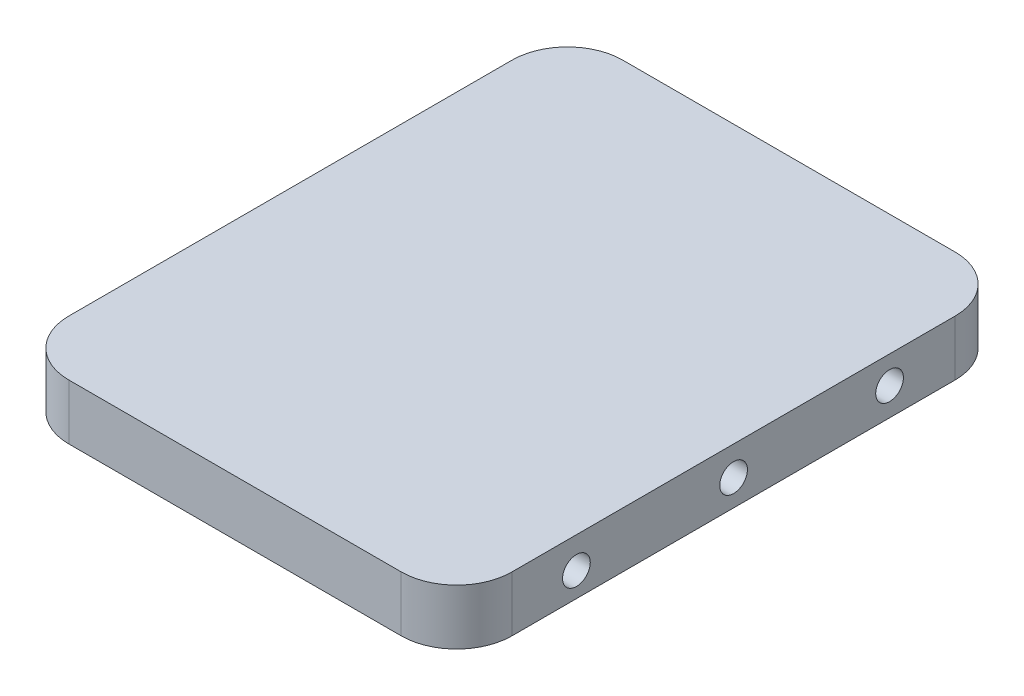
from build123d import *

# Parameters (mm, degrees)
BOSS_EXTRUDE1_DEPTH = 10
SKETCH2_R           = 2.5
CUT_EXTRUDE1_DEPTH  = 95.868329805
SKETCH4_R           = 2.5
CUT_EXTRUDE2_DEPTH  = 95.868329805
SKETCH5_R           = 2.5
CUT_EXTRUDE3_DEPTH  = 95.868329805


with BuildPart() as part:
    # Sketch1 → Boss-Extrude1 (new body)
    with BuildSketch(Plane(origin=(0, 0, 0), x_dir=(1, 0, 0), z_dir=(0, 1, 0))):
        with BuildLine():
            Line((-30, 50), (30, 50))
            ThreePointArc((30, 50), (37.071067812, 47.071067812), (40, 40))
            Line((40, 40), (40, -40))
            ThreePointArc((40, -40), (37.071067812, -47.071067812), (30, -50))
            Line((30, -50), (-30, -50))
            ThreePointArc((-30, -50), (-37.071067812, -47.071067812), (-40, -40))
            Line((-40, -40), (-40, 40))
            ThreePointArc((-40, 40), (-37.071067812, 47.071067812), (-30, 50))
        make_face()
    extrude(amount=BOSS_EXTRUDE1_DEPTH)

    # Sketch2 → Cut-Extrude1 (cut, through all)
    with BuildSketch(Plane(origin=(40, 0, 0), x_dir=(0, 0, -1), z_dir=(1, 0, 0))):
        with Locations((0, 4.743756571)):
            Circle(SKETCH2_R)
    extrude(amount=-CUT_EXTRUDE1_DEPTH, mode=Mode.SUBTRACT)

    # Sketch4 → Cut-Extrude2 (cut, through all)
    with BuildSketch(Plane(origin=(40, 0, 0), x_dir=(0, 0, -1), z_dir=(1, 0, 0))):
        with Locations((-28.371833373, 4.400978566)):
            Circle(SKETCH4_R)
    extrude(amount=-CUT_EXTRUDE2_DEPTH, mode=Mode.SUBTRACT)

    # Sketch5 → Cut-Extrude3 (cut, through all)
    with BuildSketch(Plane(origin=(40, 0, 0), x_dir=(0, 0, -1), z_dir=(1, 0, 0))):
        with Locations((28.154007397, 5.042029154)):
            Circle(SKETCH5_R)
    extrude(amount=-CUT_EXTRUDE3_DEPTH, mode=Mode.SUBTRACT)


solid = part.part
